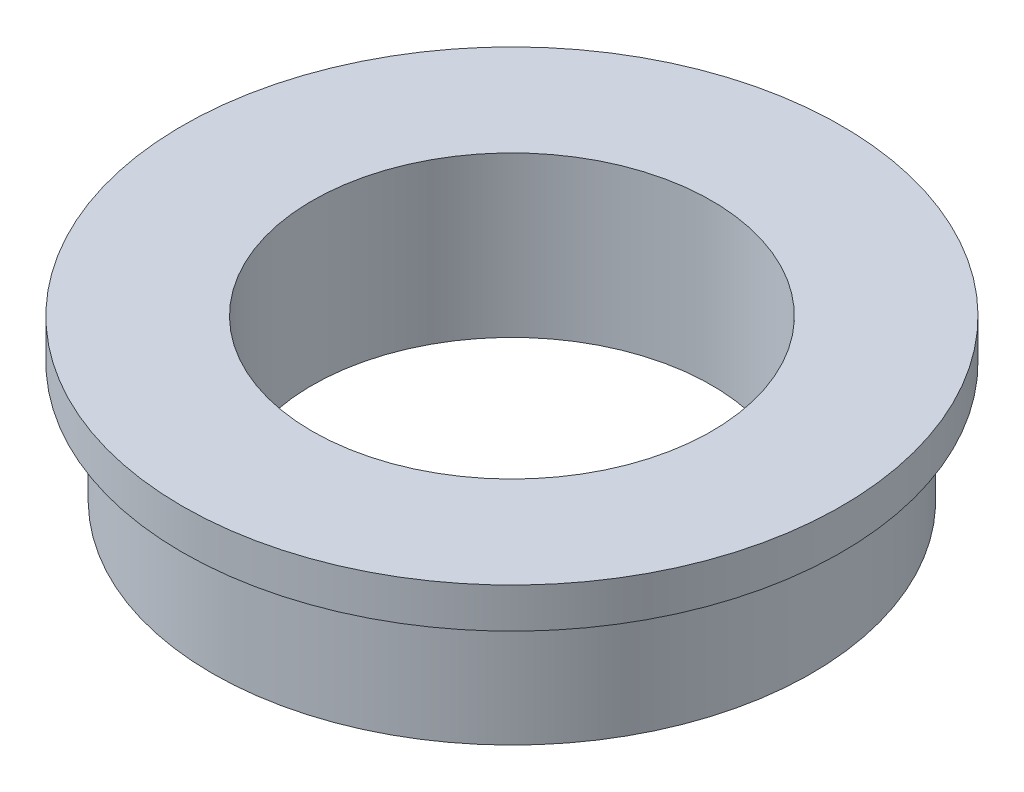
from build123d import *


with BuildPart() as part:
    # Sketch1 → Revolve1 (revolve)
    with BuildSketch(Plane(origin=(0, 0, 0), x_dir=(0, 0, -1), z_dir=(1, 0, 0)), mode=Mode.PRIVATE) as revolve1_sk:
        Polygon((8.25, -2.067727847), (8.25, -3.067727847), (7.5, -3.067727847), (7.5, -6.067727847), (5, -6.067727847), (5, -2.067727847), align=None)
    revolve(revolve1_sk.sketch.rotate(Axis((0, 4.005851113, 0), (0, -1, 0)), 180), axis=Axis((0, 4.005851113, 0), (0, -1, 0)))


solid = part.part
